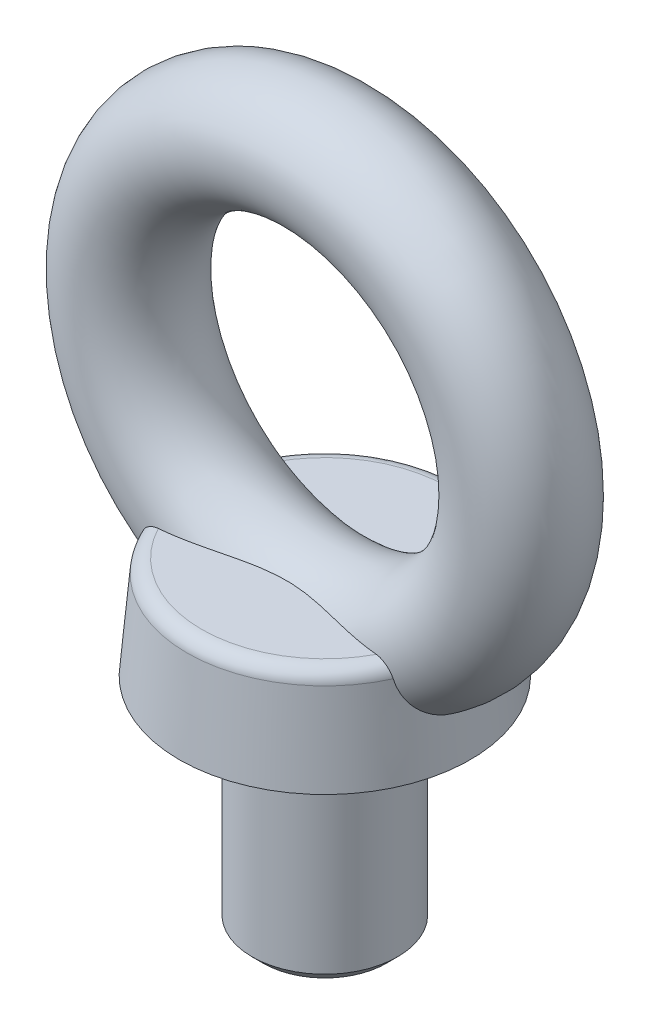
from build123d import *

# Parameters (mm, degrees)
SZKIC1_R = 8


with BuildPart() as part:
    # Szkic2 → Obrót1 (revolve)
    with BuildSketch(Plane.XY, mode=Mode.PRIVATE) as obr_t1_sk:
        with BuildLine():
            Line((0, 14), (16.942496363, 14))
            ThreePointArc((16.942496363, 14), (18.293676778, 13.474554674), (18.934885759, 12.174311485))
            Line((18.934885759, 12.174311485), (20, 0))
            Line((20, 0), (0, 0))
            Line((0, 0), (0, 14))
        make_face()
    revolve(obr_t1_sk.sketch.rotate(Axis((0, 0, 0), (0, 1, 0)), 270), axis=Axis((0, 0, 0), (0, 1, 0)))

    # Szkic1 → Obrót2 (revolve)
    with BuildSketch(Plane(origin=(0, 0, 0), x_dir=(0, 0, -1), z_dir=(1, 0, 0)), mode=Mode.PRIVATE) as obr_t2_sk:
        with Locations((0, 62)):
            Circle(SZKIC1_R)
    revolve(obr_t2_sk.sketch.rotate(Axis((0, 35, -8), (0, 0, 1)), 26.239647144), axis=Axis((0, 35, -8), (0, 0, 1)))

    # Szkic3 → Obrót3 (revolve)
    with BuildSketch(Plane.XY, mode=Mode.PRIVATE) as obr_t3_sk:
        Polygon((0, 0), (10, 0), (10, -28.4665), (8.4665, -30), (0, -30), align=None)
    revolve(obr_t3_sk.sketch.rotate(Axis((0, -30, 0), (0, 1, 0)), 270), axis=Axis((0, -30, 0), (0, 1, 0)))

    # Szkic4 → Wycięcie-obrót1 (revolve, cut)
    with BuildSketch(Plane.XY, mode=Mode.PRIVATE) as wyci_cie_obr_t1_sk:
        Polygon((9, 0), (9, -3), (10, -4), (10, 0), align=None)
    revolve(wyci_cie_obr_t1_sk.sketch.rotate(Axis((0, -30, 0), (0, 1, 0)), 270), axis=Axis((0, -30, 0), (0, 1, 0)), mode=Mode.SUBTRACT)


solid = part.part
